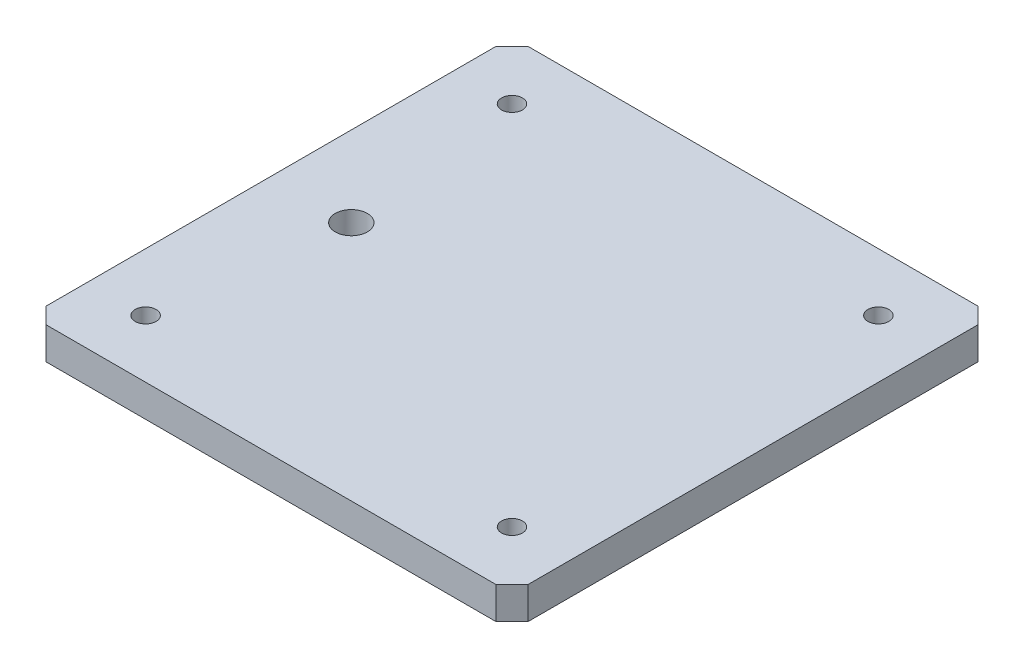
from build123d import *

# Parameters (mm, degrees)
SKETCH1_W            = 150
SKETCH1_H            = 150
BOSS_EXTRUDE1_DEPTH  = 10
CHAMFER1_SIZE        = 5
M6_CLEARANCE_HOLE1_D = 6.5
SKETCH2_R            = 5
CUT_EXTRUDE1_DEPTH   = 15


with BuildPart() as part:
    # Sketch1 → Boss-Extrude1 (new body)
    with BuildSketch(Plane(origin=(0, 0, 0), x_dir=(1, 0, 0), z_dir=(0, 1, 0))):
        Rectangle(SKETCH1_W, SKETCH1_H)
    extrude(amount=BOSS_EXTRUDE1_DEPTH)

    # Chamfer1
    chamfer1_edges = [part.edges().sort_by_distance(p)[0] for p in [
        (-75, 5, -75),
        (75, 5, -75),
        (75, 5, 75),
        (-75, 5, 75),
    ]]
    chamfer(chamfer1_edges, length=CHAMFER1_SIZE)

    # M6 Clearance Hole1 (through all)
    with Locations(Plane(origin=(0, 10, 0), x_dir=(-1, 0, 0), z_dir=(0, 1, 0))):
        with Locations((57, -57), (-57, -57), (57, 57), (-57, 57)):
            Hole(M6_CLEARANCE_HOLE1_D / 2)

    # Sketch2 → Cut-Extrude1 (cut)
    with BuildSketch(Plane(origin=(0, 10, 0), x_dir=(1, 0, 0), z_dir=(0, 1, 0))):
        with Locations(Location((-50, 0, 0), (0, 0, 270))):
            Circle(SKETCH2_R)
    extrude(amount=-CUT_EXTRUDE1_DEPTH, mode=Mode.SUBTRACT)


solid = part.part
